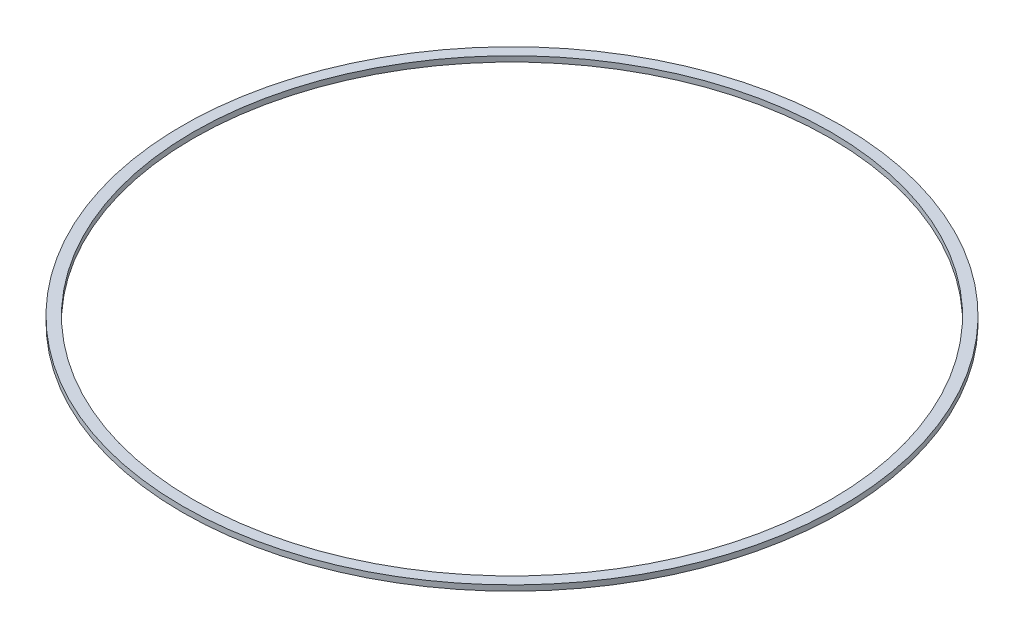
from build123d import *

# Parameters (mm, degrees)
SKETCH1_W = 1
SKETCH1_H = 0.5


with BuildPart() as part:
    # Sketch1 → Revolve1 (revolve)
    with BuildSketch(Plane.XY, mode=Mode.PRIVATE) as revolve1_sk:
        with Locations((17.994324383, 0.607142857)):
            Rectangle(SKETCH1_W, SKETCH1_H)
    revolve(revolve1_sk.sketch.rotate(Axis((-11.505675617, 2.26567821, 0), (0, -1, 0)), 90), axis=Axis((-11.505675617, 2.26567821, 0), (0, -1, 0)))


solid = part.part
